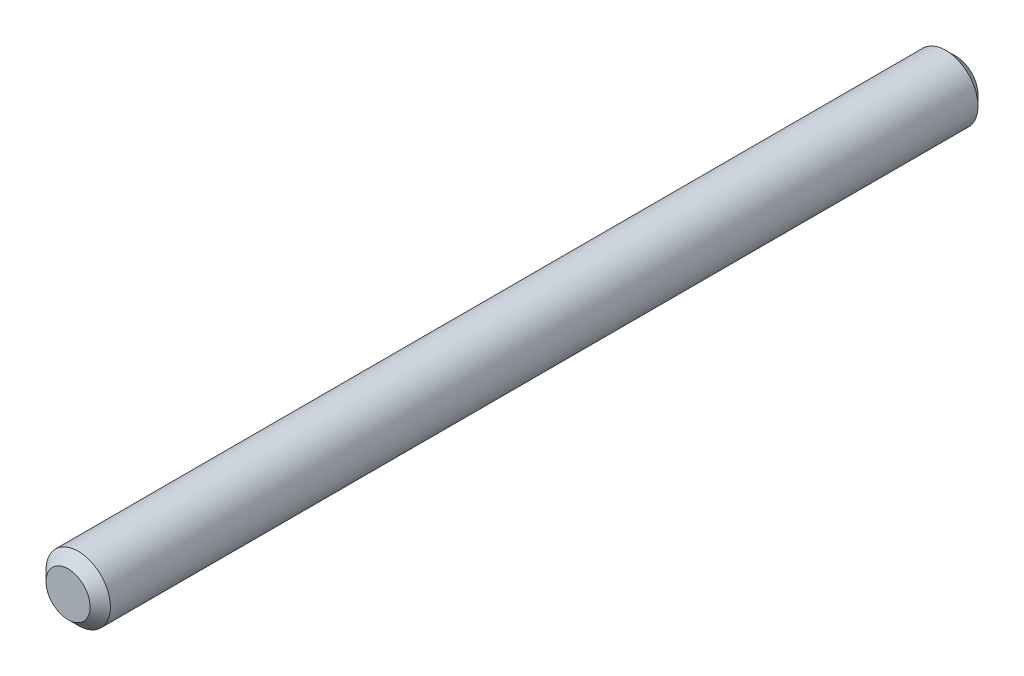
from build123d import *

# Parameters (mm, degrees)
SKETCH1_R           = 3.175
BOSS_EXTRUDE1_DEPTH = 87.5
CHAMFER1_SIZE       = 1


with BuildPart() as part:
    # Sketch1 → Boss-Extrude1 (new body)
    with BuildSketch(Plane.XY):
        Circle(SKETCH1_R)
    extrude(amount=-BOSS_EXTRUDE1_DEPTH)

    # Chamfer1
    chamfer1_edges = [part.edges().sort_by_distance(p)[0] for p in [
        (-3.175, 0, 0),
        (-3.175, 0, -87.5),
    ]]
    chamfer(chamfer1_edges, length=CHAMFER1_SIZE)


solid = part.part
